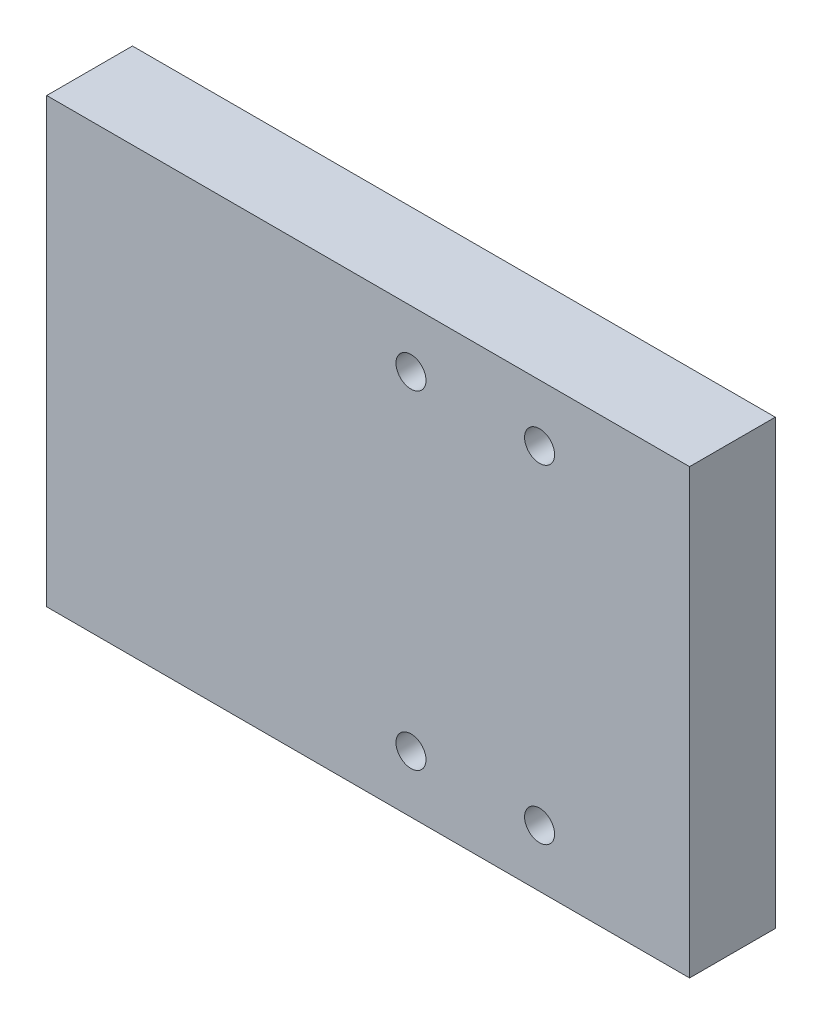
from build123d import *

# Parameters (mm, degrees)
SZKIC1_W                       = 90
SZKIC1_H                       = 62
DODANIE_WYCI_GNI_CIE1_DEPTH    = 12
OTW_R_GWINTOWANY_M5X0_81_D     = 4.2
OTW_R_GWINTOWANY_M5X0_81_DEPTH = 14
OTW_R_GWINTOWANY_M5X0_81_TIP   = 1.2618073
OTW_R_GWINTOWANY_M5X0_82_D     = 4.2
OTW_R_GWINTOWANY_M5X0_82_DEPTH = 20
OTW_R_GWINTOWANY_M5X0_82_TIP   = 1.2618073


with BuildPart() as part:
    # Szkic1 → Dodanie-wyciągnięcie1 (new body)
    with BuildSketch(Plane.XY):
        with Locations((73, 300)):
            Rectangle(SZKIC1_W, SZKIC1_H)
    extrude(amount=DODANIE_WYCI_GNI_CIE1_DEPTH)

    # Otwór gwintowany M5x0.81
    with Locations(Plane.XY.offset(12)):
        with Locations((97, 323), (79, 323), (79, 277), (97, 277)):
            Hole(OTW_R_GWINTOWANY_M5X0_81_D / 2, depth=OTW_R_GWINTOWANY_M5X0_81_DEPTH)
            with Locations((0, 0, -(OTW_R_GWINTOWANY_M5X0_81_DEPTH + OTW_R_GWINTOWANY_M5X0_81_TIP / 2))):  # 118° drill point
                Cone(0, OTW_R_GWINTOWANY_M5X0_81_D / 2, OTW_R_GWINTOWANY_M5X0_81_TIP, mode=Mode.SUBTRACT)

    # Otwór gwintowany M5x0.82
    with Locations(Plane.ZY.offset(-28)):
        with Locations((6, 286), (6, 314)):
            Hole(OTW_R_GWINTOWANY_M5X0_82_D / 2, depth=OTW_R_GWINTOWANY_M5X0_82_DEPTH)
            with Locations((0, 0, -(OTW_R_GWINTOWANY_M5X0_82_DEPTH + OTW_R_GWINTOWANY_M5X0_82_TIP / 2))):  # 118° drill point
                Cone(0, OTW_R_GWINTOWANY_M5X0_82_D / 2, OTW_R_GWINTOWANY_M5X0_82_TIP, mode=Mode.SUBTRACT)


solid = part.part
